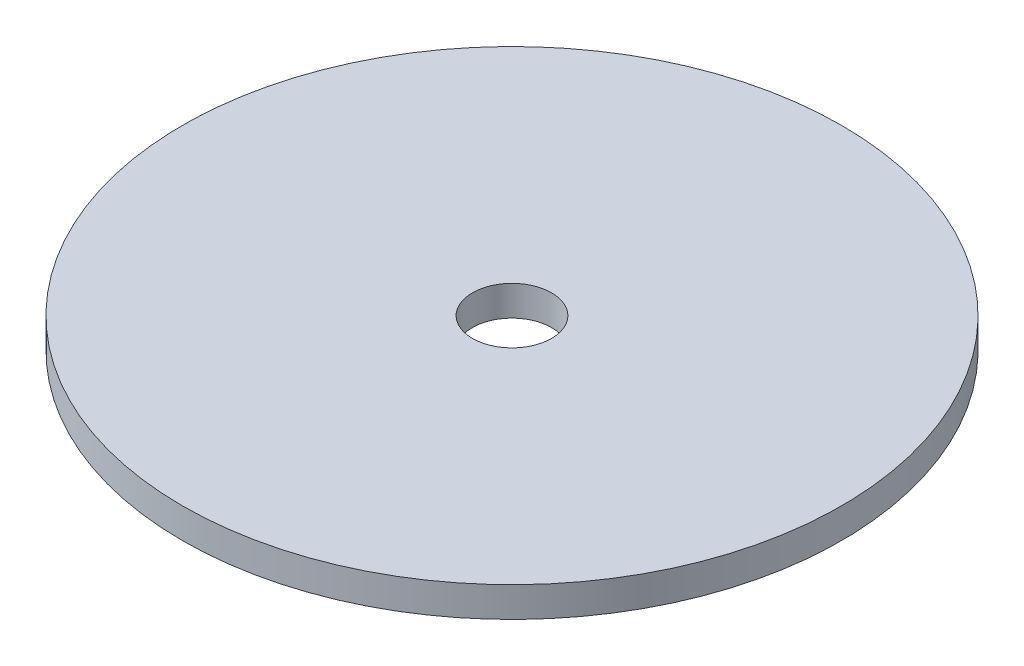
from build123d import *

# Parameters (mm, degrees)
SKETCH_2_R      = 17.5
SKETCH_2_R_2    = 2.1
EXTRUDE_2_DEPTH = 1.6


with BuildPart() as part:
    # ｽｹｯﾁ2 → ﾎﾞｽ - 押し出し2 (new body)
    with BuildSketch(Plane(origin=(0, 0, 0), x_dir=(-1, 0, 0), z_dir=(0, 1, 0))):
        with Locations(Location((0, 0, 0), (0, 0, 90))):
            Circle(SKETCH_2_R)
        with Locations(Location((0, 0, 0), (0, 0, 90))):
            Circle(SKETCH_2_R_2, mode=Mode.SUBTRACT)
    extrude(amount=EXTRUDE_2_DEPTH)


solid = part.part
